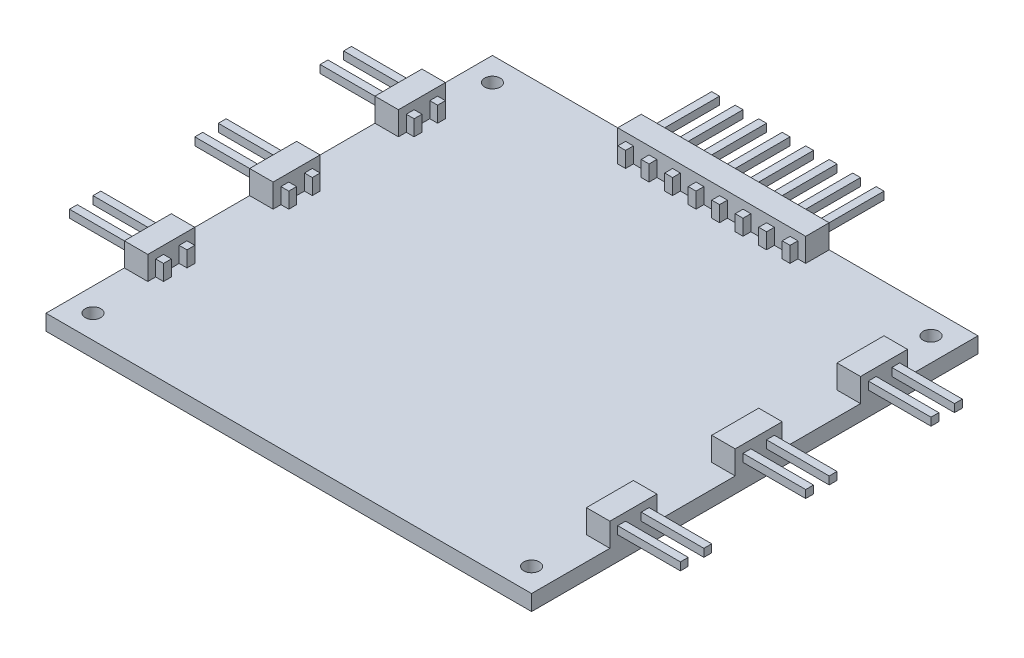
from build123d import *

# Parameters (mm, degrees)
SKETCH1_W           = 49.2125
SKETCH1_H           = 45.24375
BOSS_EXTRUDE2_DEPTH = 1.5875
SKETCH2_W           = 0.79375
SKETCH2_H           = 0.79375
BOSS_EXTRUDE4_DEPTH = 0.79375
BOSS_EXTRUDE5_START = 0.79375
SKETCH2_3_W         = 9.525
SKETCH2_3_H         = 0.79375
BOSS_EXTRUDE5_DEPTH = 0.79375
SKETCH3_W           = 2.38125
SKETCH3_H           = 4.7625
BOSS_EXTRUDE6_DEPTH = 2.38125
SKETCH4_W           = 0.79375
SKETCH4_H           = 0.79375
BOSS_EXTRUDE7_DEPTH = 0.79375
BOSS_EXTRUDE8_START = 0.79375
SKETCH4_3_W         = 0.79375
SKETCH4_3_H         = 9.525
BOSS_EXTRUDE8_DEPTH = 0.79375
SKETCH5_W           = 19.05
SKETCH5_H           = 2.38125
BOSS_EXTRUDE9_DEPTH = 2.38125
SKETCH12_R          = 0.79375
CUT_EXTRUDE1_DEPTH  = 43.465625


with BuildPart() as part:
    # Sketch1 → Boss-Extrude2 (new body)
    with BuildSketch(Plane(origin=(0, 0, 0), x_dir=(1, 0, 0), z_dir=(0, 1, 0))):
        Rectangle(SKETCH1_W, SKETCH1_H)
    extrude(amount=BOSS_EXTRUDE2_DEPTH)

    # Sketch2 → Boss-Extrude4 (add)
    with BuildSketch(Plane(origin=(0, 1.5875, 0), x_dir=(1, 0, 0), z_dir=(0, 1, 0))):
        with Locations((21.828125, 14.2875)):
            Rectangle(SKETCH2_W, SKETCH2_H)
        with Locations((21.828125, 11.90625)):
            Rectangle(SKETCH2_W, SKETCH2_H)
        with Locations((21.828125, 1.5875)):
            Rectangle(SKETCH2_W, SKETCH2_H)
        with Locations((21.828125, -0.79375)):
            Rectangle(SKETCH2_W, SKETCH2_H)
        with Locations((21.828125, -11.1125)):
            Rectangle(SKETCH2_W, SKETCH2_H)
        with Locations((21.828125, -13.49375)):
            Rectangle(SKETCH2_W, SKETCH2_H)
        with Locations((-21.828125, -13.49375)):
            Rectangle(SKETCH2_W, SKETCH2_H)
        with Locations((-21.828125, -11.1125)):
            Rectangle(SKETCH2_W, SKETCH2_H)
        with Locations((-21.828125, -0.79375)):
            Rectangle(SKETCH2_W, SKETCH2_H)
        with Locations((-21.828125, 1.5875)):
            Rectangle(SKETCH2_W, SKETCH2_H)
        with Locations((-21.828125, 11.90625)):
            Rectangle(SKETCH2_W, SKETCH2_H)
        with Locations((-21.828125, 14.2875)):
            Rectangle(SKETCH2_W, SKETCH2_H)
    extrude(amount=BOSS_EXTRUDE4_DEPTH)

    # Sketch2<3> → Boss-Extrude5 (add)
    with BuildSketch(Plane(origin=(0, 1.5875, 0), x_dir=(1, 0, 0), z_dir=(0, 1, 0)).offset(BOSS_EXTRUDE5_START)):
        with Locations((26.19375, 14.2875)):
            Rectangle(SKETCH2_3_W, SKETCH2_3_H)
        with Locations((26.19375, 11.90625)):
            Rectangle(SKETCH2_3_W, SKETCH2_3_H)
        with Locations((26.19375, 1.5875)):
            Rectangle(SKETCH2_3_W, SKETCH2_3_H)
        with Locations((26.19375, -0.79375)):
            Rectangle(SKETCH2_3_W, SKETCH2_3_H)
        with Locations((26.19375, -11.1125)):
            Rectangle(SKETCH2_3_W, SKETCH2_3_H)
        with Locations((26.19375, -13.49375)):
            Rectangle(SKETCH2_3_W, SKETCH2_3_H)
        with Locations((-26.19375, 14.2875)):
            Rectangle(SKETCH2_3_W, SKETCH2_3_H)
        with Locations((-26.19375, 11.90625)):
            Rectangle(SKETCH2_3_W, SKETCH2_3_H)
        with Locations((-26.19375, 1.5875)):
            Rectangle(SKETCH2_3_W, SKETCH2_3_H)
        with Locations((-26.19375, -0.79375)):
            Rectangle(SKETCH2_3_W, SKETCH2_3_H)
        with Locations((-26.19375, -11.1125)):
            Rectangle(SKETCH2_3_W, SKETCH2_3_H)
        with Locations((-26.19375, -13.49375)):
            Rectangle(SKETCH2_3_W, SKETCH2_3_H)
    extrude(amount=BOSS_EXTRUDE5_DEPTH)

    # Sketch3 → Boss-Extrude6 (add)
    with BuildSketch(Plane(origin=(0, 1.5875, 0), x_dir=(1, 0, 0), z_dir=(0, 1, 0))):
        with Locations((-23.415625, 13.096875)):
            Rectangle(SKETCH3_W, SKETCH3_H)
        with Locations((-23.415625, 0.396875)):
            Rectangle(SKETCH3_W, SKETCH3_H)
        with Locations((-23.415625, -12.303125)):
            Rectangle(SKETCH3_W, SKETCH3_H)
        with Locations((23.415625, -12.303125)):
            Rectangle(SKETCH3_W, SKETCH3_H)
        with Locations((23.415625, 0.396875)):
            Rectangle(SKETCH3_W, SKETCH3_H)
        with Locations((23.415625, 13.096875)):
            Rectangle(SKETCH3_W, SKETCH3_H)
    extrude(amount=BOSS_EXTRUDE6_DEPTH)

    # Sketch4 → Boss-Extrude7 (add)
    with BuildSketch(Plane(origin=(0, 1.5875, 0), x_dir=(1, 0, 0), z_dir=(0, 1, 0))):
        with Locations((8.334375, 19.84375)):
            Rectangle(SKETCH4_W, SKETCH4_H)
        with Locations((-1.190625, 19.84375)):
            Rectangle(SKETCH4_W, SKETCH4_H)
        with Locations((-3.571875, 19.84375)):
            Rectangle(SKETCH4_W, SKETCH4_H)
        with Locations((-5.953125, 19.84375)):
            Rectangle(SKETCH4_W, SKETCH4_H)
        with Locations((-8.334375, 19.84375)):
            Rectangle(SKETCH4_W, SKETCH4_H)
        with Locations((5.953125, 19.84375)):
            Rectangle(SKETCH4_W, SKETCH4_H)
        with Locations((3.571875, 19.84375)):
            Rectangle(SKETCH4_W, SKETCH4_H)
        with Locations((1.190625, 19.84375)):
            Rectangle(SKETCH4_W, SKETCH4_H)
    extrude(amount=BOSS_EXTRUDE7_DEPTH)

    # Sketch4<3> → Boss-Extrude8 (add)
    with BuildSketch(Plane(origin=(0, 1.5875, 0), x_dir=(1, 0, 0), z_dir=(0, 1, 0)).offset(BOSS_EXTRUDE8_START)):
        with Locations((8.334375, 24.209375)):
            Rectangle(SKETCH4_3_W, SKETCH4_3_H)
        with Locations((-1.190625, 24.209375)):
            Rectangle(SKETCH4_3_W, SKETCH4_3_H)
        with Locations((-3.571875, 24.209375)):
            Rectangle(SKETCH4_3_W, SKETCH4_3_H)
        with Locations((-5.953125, 24.209375)):
            Rectangle(SKETCH4_3_W, SKETCH4_3_H)
        with Locations((-8.334375, 24.209375)):
            Rectangle(SKETCH4_3_W, SKETCH4_3_H)
        with Locations((5.953125, 24.209375)):
            Rectangle(SKETCH4_3_W, SKETCH4_3_H)
        with Locations((3.571875, 24.209375)):
            Rectangle(SKETCH4_3_W, SKETCH4_3_H)
        with Locations((1.190625, 24.209375)):
            Rectangle(SKETCH4_3_W, SKETCH4_3_H)
    extrude(amount=BOSS_EXTRUDE8_DEPTH)

    # Sketch5 → Boss-Extrude9 (add)
    with BuildSketch(Plane(origin=(0, 1.5875, 0), x_dir=(1, 0, 0), z_dir=(0, 1, 0))):
        with Locations((0, 21.43125)):
            Rectangle(SKETCH5_W, SKETCH5_H)
    extrude(amount=BOSS_EXTRUDE9_DEPTH)

    # Sketch12 → Cut-Extrude1 (cut, through all)
    with BuildSketch(Plane(origin=(0, 1.5875, 0), x_dir=(1, 0, 0), z_dir=(0, 1, 0))):
        with Locations((-22.225, 20.240625)):
            Circle(SKETCH12_R)
        with Locations((-22.225, -20.240625)):
            Circle(SKETCH12_R)
        with Locations((22.225, -20.240625)):
            Circle(SKETCH12_R)
        with Locations((22.225, 20.240625)):
            Circle(SKETCH12_R)
    extrude(amount=-CUT_EXTRUDE1_DEPTH, mode=Mode.SUBTRACT)


solid = part.part
